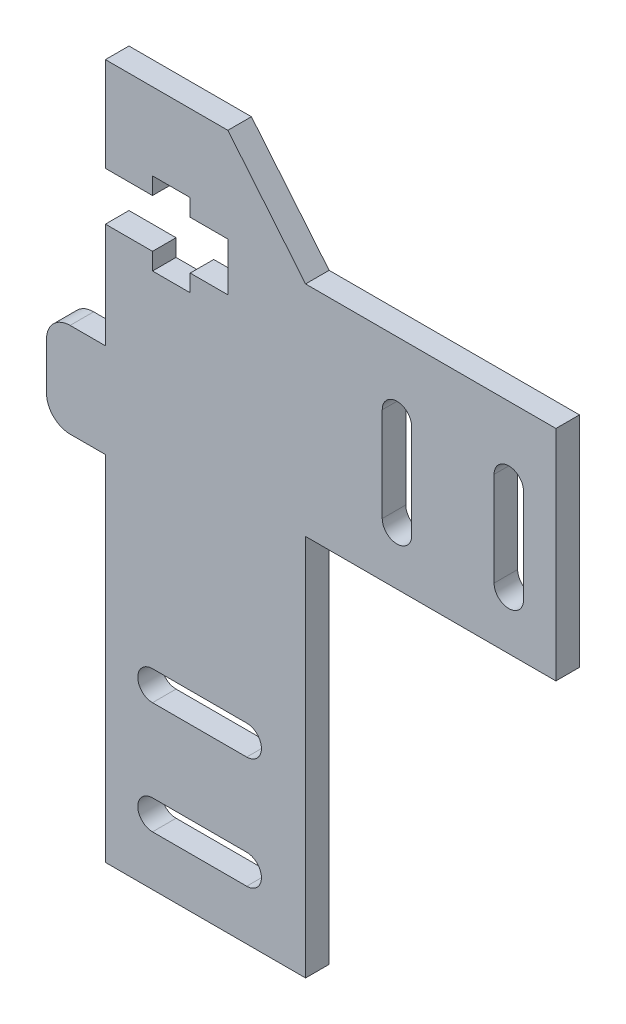
from build123d import *

# Parameters (mm, degrees)
EXTRUDE_1_DEPTH = 2
FILLET_1_R      = 2


with BuildPart() as part:
    # 草图1 → 凸台-拉伸1 (new body)
    with BuildSketch(Plane.XY):
        Polygon((-8.301811847, -11.701358885), (-3.301811847, -11.701358885), (-3.301811847, -41.701358885), (13.698188153, -41.701358885), (13.698188153, -9.223166137), (34.95900929, -9.223166137), (34.95900929, 9.348641115), (13.698188153, 9.348641115), (7.098188153, 17.348641115), (-3.301811847, 17.348641115), (-3.301811847, 9.348641115), (0.698188153, 9.348641115), (0.698188153, 10.798641115), (3.898188153, 10.798641115), (3.898188153, 9.348641115), (7.098188153, 9.348641115), (7.098188153, 5.248641115), (3.898188153, 5.248641115), (3.898188153, 3.798641115), (0.698188153, 3.798641115), (0.698188153, 5.248641115), (-3.301811847, 5.248641115), (-3.301811847, -3.701358885), (-8.301811847, -3.701358885), align=None)
        with BuildLine():
            Line((0.698188153, -25.451358885), (8.698188153, -25.451358885))
            ThreePointArc((8.698188153, -25.451358885), (9.948188153, -26.701358885), (8.698188153, -27.951358885))
            Line((8.698188153, -27.951358885), (0.698188153, -27.951358885))
            ThreePointArc((0.698188153, -27.951358885), (-0.551811847, -26.701358885), (0.698188153, -25.451358885))
        make_face(mode=Mode.SUBTRACT)
        with BuildLine():
            Line((8.698188153, -37.451358885), (0.698188153, -37.451358885))
            ThreePointArc((0.698188153, -37.451358885), (-0.551811847, -36.201358885), (0.698188153, -34.951358885))
            Line((0.698188153, -34.951358885), (8.698188153, -34.951358885))
            ThreePointArc((8.698188153, -34.951358885), (9.948188153, -36.201358885), (8.698188153, -37.451358885))
        make_face(mode=Mode.SUBTRACT)
        with BuildLine():
            Line((32.20900929, 3.348641115), (32.20900929, -4.651358885))
            ThreePointArc((32.20900929, -4.651358885), (30.95900929, -5.901358885), (29.70900929, -4.651358885))
            Line((29.70900929, -4.651358885), (29.70900929, 3.348641115))
            ThreePointArc((29.70900929, 3.348641115), (30.95900929, 4.598641115), (32.20900929, 3.348641115))
        make_face(mode=Mode.SUBTRACT)
        with BuildLine():
            Line((22.70900929, 3.348641115), (22.70900929, -4.651358885))
            ThreePointArc((22.70900929, -4.651358885), (21.45900929, -5.901358885), (20.20900929, -4.651358885))
            Line((20.20900929, -4.651358885), (20.20900929, 3.348641115))
            ThreePointArc((20.20900929, 3.348641115), (21.45900929, 4.598641115), (22.70900929, 3.348641115))
        make_face(mode=Mode.SUBTRACT)
    extrude(amount=EXTRUDE_1_DEPTH)

    # 圆角1
    fillet_1_edges = [part.edges().sort_by_distance(p)[0] for p in [
        (-8.301811847, -3.701358885, 1),
        (-8.301811847, -11.701358885, 1),
    ]]
    fillet(fillet_1_edges, radius=FILLET_1_R)


solid = part.part
